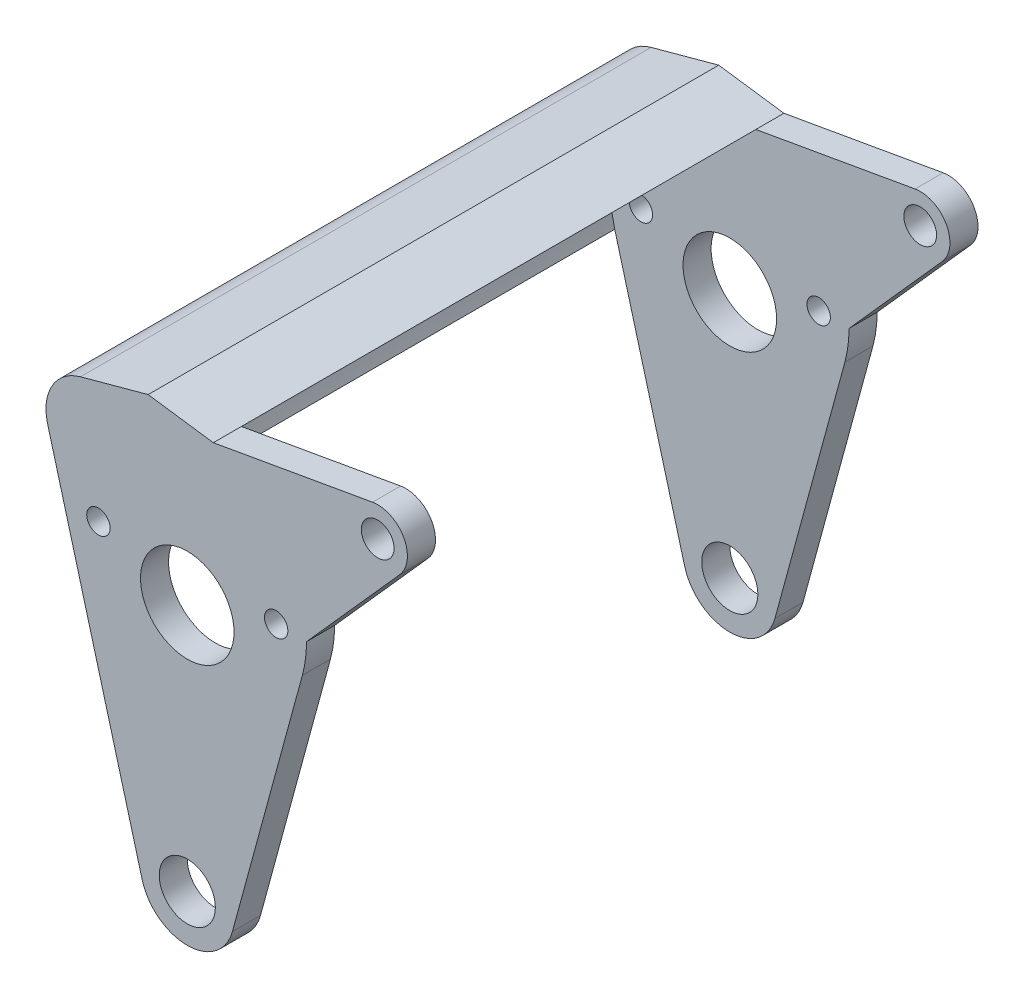
from build123d import *

# Parameters (mm, degrees)
SKETCH1_R           = 3
SKETCH1_R_2         = 5
SKETCH1_R_3         = 1.25
BOSS_EXTRUDE1_DEPTH = 3
SKETCH2_R           = 1.75
BOSS_EXTRUDE2_DEPTH = 3
BOSS_EXTRUDE3_DEPTH = 30.5


with BuildPart() as part:
    # Sketch1 → Boss-Extrude1 (new body)
    with BuildSketch(Plane.XY):
        with BuildLine():
            Line((-4.824371659, -30.813559322), (-12.302147731, -3.349576271))
            ThreePointArc((-12.302147731, -3.349576271), (0, 12.75), (12.302147731, -3.349576271))
            Line((12.302147731, -3.349576271), (4.824371659, -30.813559322))
            ThreePointArc((4.824371659, -30.813559322), (0, -34.5), (-4.824371659, -30.813559322))
        make_face()
        with Locations((0, -29.5)):
            Circle(SKETCH1_R, mode=Mode.SUBTRACT)
        with Locations((0, -3)):
            Circle(SKETCH1_R_2, mode=Mode.SUBTRACT)
        with Locations((-9.5, 0)):
            Circle(SKETCH1_R_3, mode=Mode.SUBTRACT)
        with Locations((9.5, 0)):
            Circle(SKETCH1_R_3, mode=Mode.SUBTRACT)
    boss_extrude1 = extrude(amount=BOSS_EXTRUDE1_DEPTH)

    # Sketch2 → Boss-Extrude2 (add)
    with BuildSketch(Plane.XY):
        with BuildLine():
            Line((-2.214014265, 12.556298851), (19.806700742, 16.439145041))
            ThreePointArc((19.806700742, 16.439145041), (23.131694024, 14.858482542), (22.729129297, 11.198972206))
            Line((22.729129297, 11.198972206), (12.75, 0))
            ThreePointArc((12.75, 0), (8.195542024, 9.76706665), (-2.214014265, 12.556298851))
        make_face()
        with Locations((20.358155694, 13.311688597)):
            Circle(SKETCH2_R, mode=Mode.SUBTRACT)
    boss_extrude2 = extrude(amount=BOSS_EXTRUDE2_DEPTH)

    # Sketch4 → Boss-Extrude3 (add)
    with BuildSketch(Plane.XY):
        with BuildLine():
            Line((-12.302147731, -3.349576271), (-14.929266375, 6.299167048))
            ThreePointArc((-14.929266375, 6.299167048), (-14.445067335, 10.095245581), (-11.418454038, 12.437098029))
            Line((-11.418454038, 12.437098029), (-4.181896549, 14.407437012))
            Line((-4.181896549, 14.407437012), (2.785985735, 13.437933754))
            Line((2.785985735, 13.437933754), (-2.214014265, 12.556298851))
            ThreePointArc((-2.214014265, 12.556298851), (-10.767030957, 6.828875777), (-12.302147731, -3.349576271))
        make_face()
    boss_extrude3 = extrude(amount=BOSS_EXTRUDE3_DEPTH)

    # Mirror2: Boss-Extrude1, Boss-Extrude2, Boss-Extrude3 across plane
    add(boss_extrude1.mirror(Plane.XY.offset(30.5)))
    add(boss_extrude2.mirror(Plane.XY.offset(30.5)))
    add(boss_extrude3.mirror(Plane.XY.offset(30.5)))


solid = part.part
